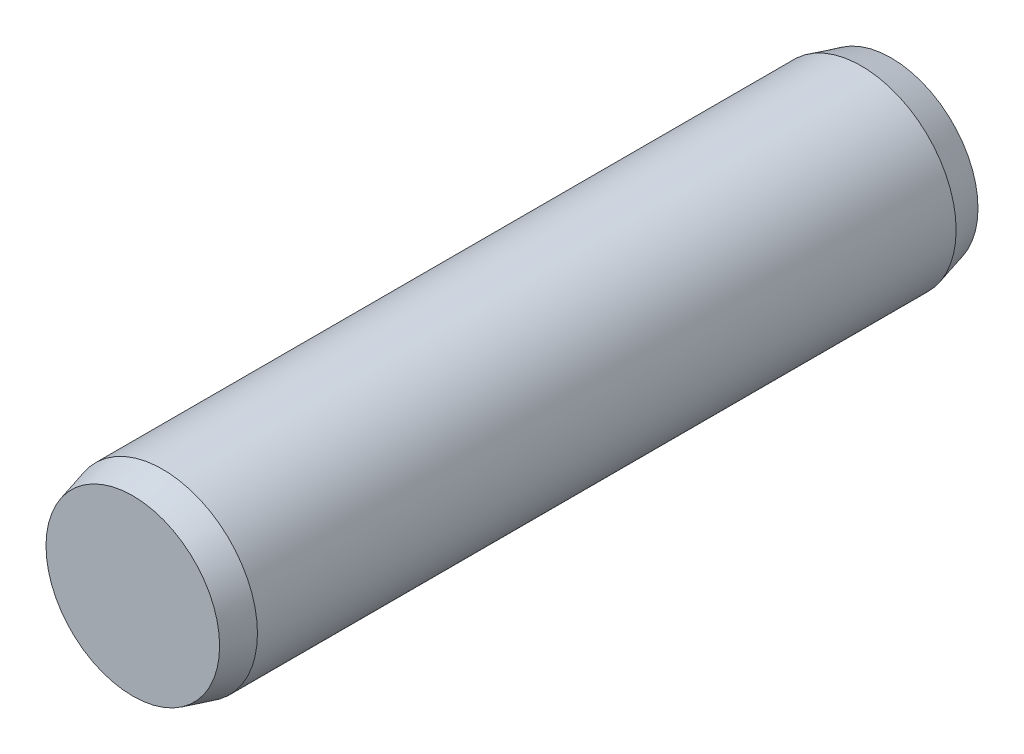
from build123d import *


with BuildPart() as part:
    # Sketch3 → Revolve1 (revolve)
    with BuildSketch(Plane(origin=(0, 0, 0), x_dir=(0, 0, -1), z_dir=(1, 0, 0)), mode=Mode.PRIVATE) as revolve1_sk:
        Polygon((-8, 0), (-8, 1.831192009), (-7.37, 2), (7.37, 2), (8, 1.831192009), (8, 0), align=None)
    revolve(revolve1_sk.sketch.rotate(Axis((0, 0, 8), (0, 0, -1)), 90), axis=Axis((0, 0, 8), (0, 0, -1)))


solid = part.part
